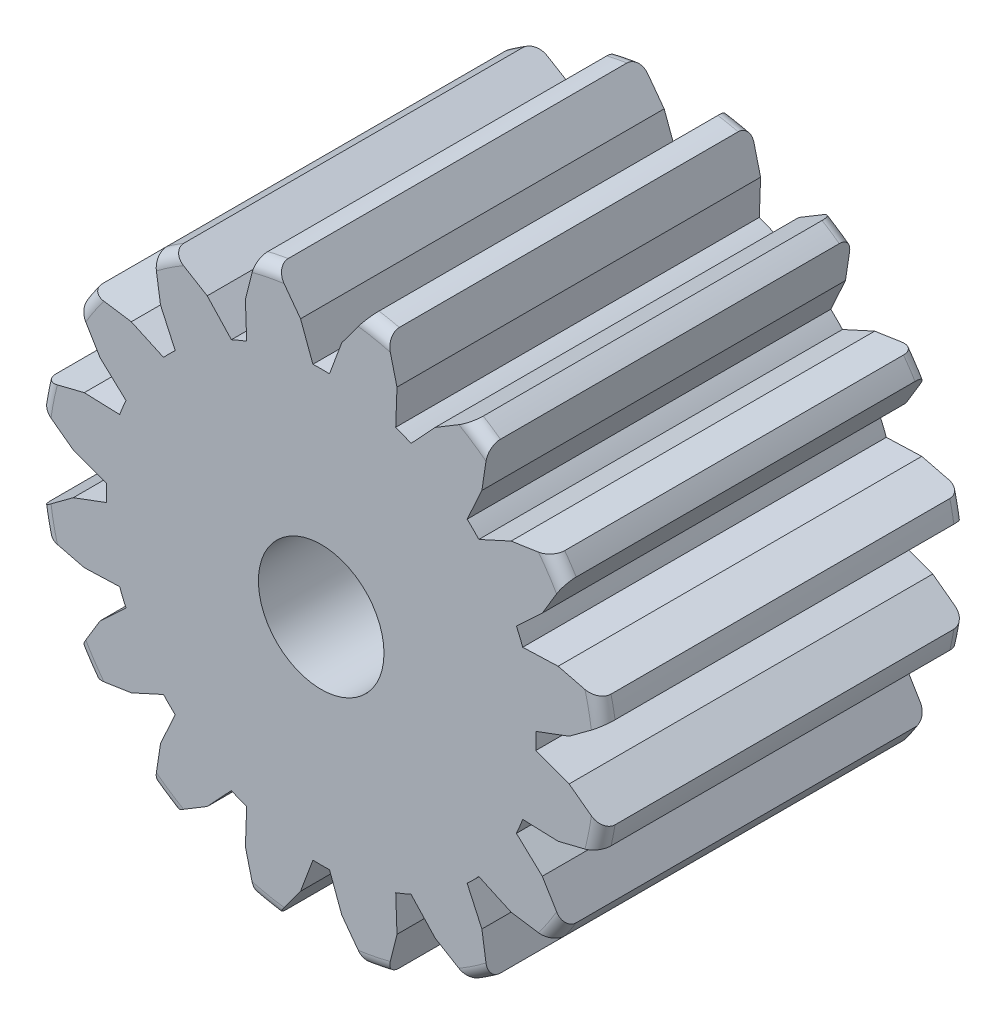
from build123d import *

# Parameters (mm, degrees)
CROQUIS1_R              = 3.45
SALIENTE_EXTRUIR1_DEPTH = 4.4
CORTAR_EXTRUIR1_DEPTH   = 4.4
REDONDEO1_R             = 0.15
MATRIZC1_COUNT          = 16
CROQUIS2_3_R            = 0.76
CORTAR_EXTRUIR2_DEPTH   = 4.4


with BuildPart() as part:
    # Croquis1 → Saliente-Extruir1 (new body)
    with BuildSketch(Plane.XY):
        Circle(CROQUIS1_R)
    extrude(amount=SALIENTE_EXTRUIR1_DEPTH)

    # Croquis2 → Cortar-Extruir1 (cut)
    with BuildSketch(Plane.XY.offset(4.4)):
        with BuildLine():
            ThreePointArc((-0.1, 2.598076211), (0, 2.6), (0.1, 2.598076211))
            Line((0.1, 2.598076211), (0.25, 3))
            Line((0.25, 3), (0.55, 3.405877273))
            Line((0.55, 3.405877273), (0.55, 3.7))
            Line((0.55, 3.7), (-0.55, 3.7))
            Line((-0.55, 3.7), (-0.55, 3.405877273))
            Line((-0.55, 3.405877273), (-0.25, 3))
            Line((-0.25, 3), (-0.1, 2.598076211))
        make_face()
    cortar_extruir1 = extrude(amount=-CORTAR_EXTRUIR1_DEPTH, mode=Mode.SUBTRACT)

    # Redondeo1
    redondeo1_edges = [part.edges().sort_by_distance(p)[0] for p in [
        (0, -3.45, 0),
        (0, -3.45, 4.4),
    ]]
    fillet(redondeo1_edges, radius=REDONDEO1_R)

    # MatrizC1: Cortar-Extruir1 ×16 about axis
    matrizc1_axis = Axis((0, 0, 4.4), (0, 0, -1))
    for i in range(1, MATRIZC1_COUNT):
        add(cortar_extruir1.rotate(matrizc1_axis, i * 360 / MATRIZC1_COUNT), mode=Mode.SUBTRACT)

    # Croquis2<3> → Cortar-Extruir2 (cut)
    with BuildSketch(Plane.XY.offset(4.4)):
        Circle(CROQUIS2_3_R)
    extrude(amount=-CORTAR_EXTRUIR2_DEPTH, mode=Mode.SUBTRACT)


solid = part.part
